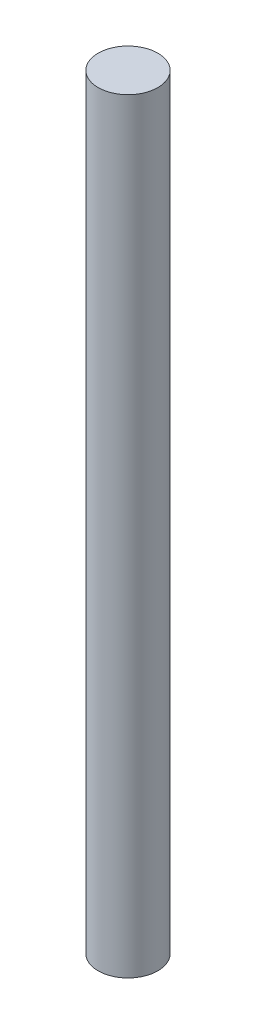
from build123d import *

# Parameters (mm, degrees)
SKETCH1_R           = 1950
BOSS_EXTRUDE1_DEPTH = 50000
SCALE1_SCALE        = 0.001


with BuildPart() as part:
    # Sketch1 → Boss-Extrude1 (new body)
    with BuildSketch(Plane(origin=(0, 0, 0), x_dir=(1, 0, 0), z_dir=(0, 1, 0))):
        with Locations(Location((1750.000080079, -1750.000104557, 0), (0, 0, 270))):
            Circle(SKETCH1_R)
    extrude(amount=-BOSS_EXTRUDE1_DEPTH)


with BuildPart() as part_1:
    # Scale1: scaled about (1750.000080079, -25000, 1750.000104557)
    add(part.part.scale(SCALE1_SCALE).moved(Location((1748.250079999, -24975, 1748.250104452))))


solid = part_1.part
